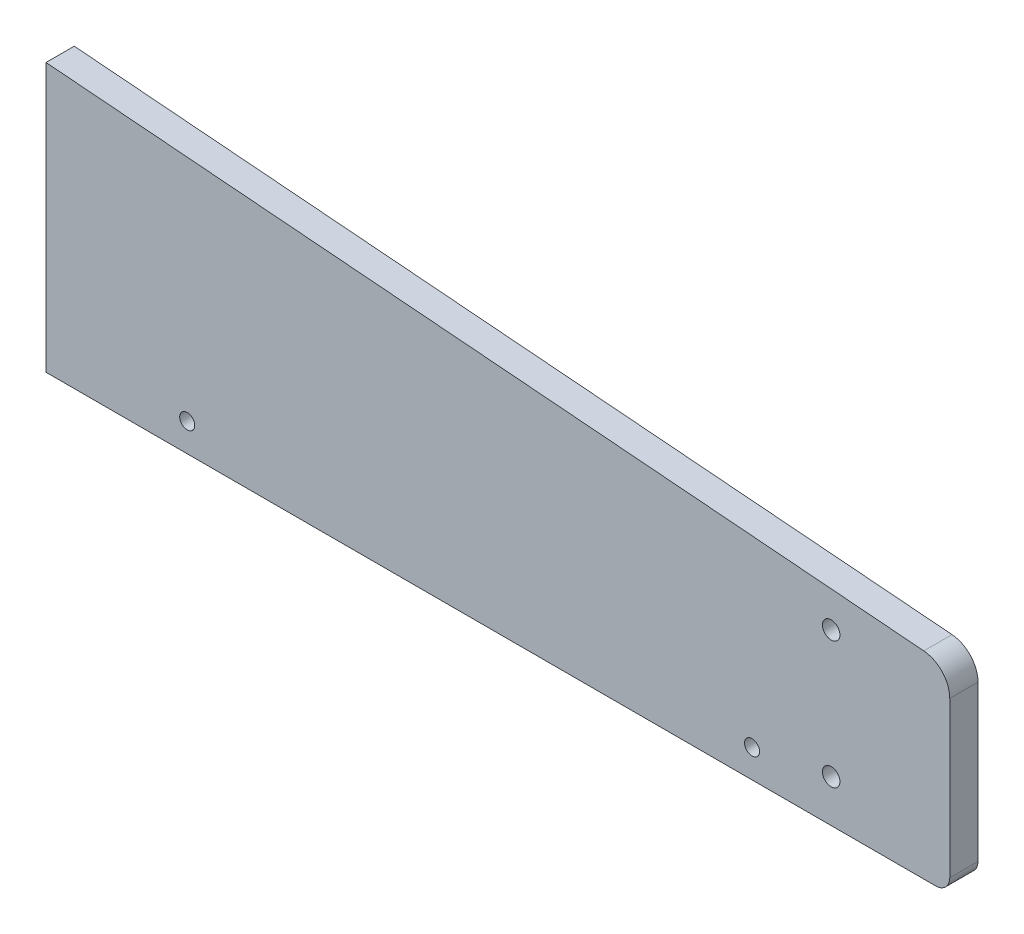
from build123d import *

# Parameters (mm, degrees)
BOSS_EXTRUDE1_DEPTH = 12.7
SKETCH2_R           = 3.3782
CUT_EXTRUDE1_DEPTH  = 486.307863629
FILLET1_R           = 6.35
SKETCH4_R           = 3.937
CUT_EXTRUDE2_DEPTH  = 486.307863629


with BuildPart() as part:
    # Sketch1 → Boss-Extrude1 (new body)
    with BuildSketch(Plane.XY):
        with BuildLine():
            Line((63.5, 0), (63.5, 120.65))
            Line((63.5, 120.65), (458.219565432, 88.85900811))
            ThreePointArc((458.219565432, 88.85900811), (466.533768826, 84.812244743), (469.9, 76.2))
            Line((469.9, 76.2), (469.9, 0))
            Line((469.9, 0), (63.5, 0))
        make_face()
    extrude(amount=BOSS_EXTRUDE1_DEPTH)

    # Sketch2 → Cut-Extrude1 (cut, through all)
    with BuildSketch(Plane.XY.offset(12.7)):
        with Locations((127, 12.7)):
            Circle(SKETCH2_R)
        with Locations((381, 12.7)):
            Circle(SKETCH2_R)
    extrude(amount=-CUT_EXTRUDE1_DEPTH, mode=Mode.SUBTRACT)

    # Fillet1
    fillet1_edges = [part.edges().sort_by_distance(p)[0] for p in [
        (469.9, 0, 6.35),
    ]]
    fillet(fillet1_edges, radius=FILLET1_R)

    # Sketch4 → Cut-Extrude2 (cut, through all)
    with BuildSketch(Plane(origin=(0, 0, 0), x_dir=(-1, 0, 0), z_dir=(0, 0, -1))):
        with Locations((-416.56762, 76.2)):
            Circle(SKETCH4_R)
        with Locations((-416.56762, 19.05)):
            Circle(SKETCH4_R)
    extrude(amount=-CUT_EXTRUDE2_DEPTH, mode=Mode.SUBTRACT)


solid = part.part
